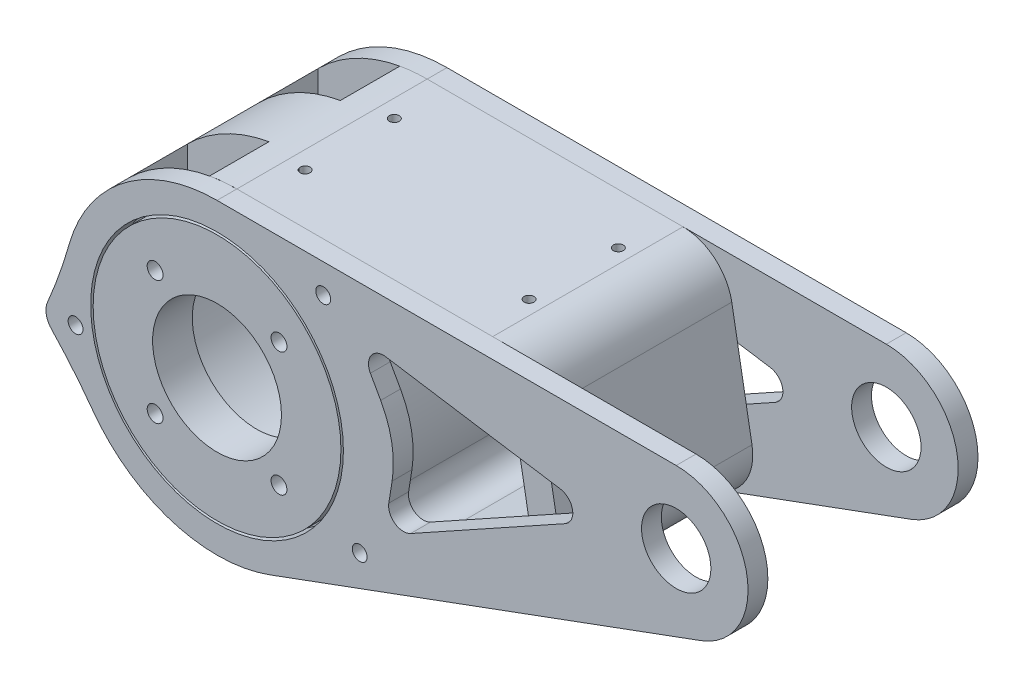
from build123d import *

# Parameters (mm, degrees)
SKETCH_1_R               = 31
SKETCH_1_R_2             = 21
EXTRUDE_1_DEPTH          = 23.2
SKETCH_2_R               = 31
SKETCH_2_R_2             = 13
EXTRUDE_2_DEPTH          = 8
SKETCH_3_R               = 1.6
CUT_EXTRUDE_1_DEPTH      = 64.835413369
EXTRUDE_3_DEPTH          = 46.4
FILLET_1_R               = 10
CUT_EXTRUDE_START        = -4
SKETCH_7_R               = 25
CUT_EXTRUDE_4_DEPTH      = 4
CUT_EXTRUDE_5_DEPTH      = 85.11408343
FILLET_2_R               = 5
SKETCH_9_R               = 7
SKETCH_9_R_2             = 25.5
EXTRUDE_4_DEPTH          = 4
SKETCH_10_R              = 1.5
CUT_EXTRUDE_6_DEPTH      = 121.810533784
EXTRUDE_5_DEPTH          = 38.4
FILLET_3_R               = 100
CUT_EXTRUDE_8_DEPTH      = 120.331408604
CUT_EXTRUDE_8_DEPTH_BACK = 120.331408604
SKETCH_14_R              = 1.5
EXTRUDE_6_DEPTH          = 4
CUT_EXTRUDE_9_DEPTH      = 121.81053381
FILLET_4_R               = 20
FILLET_5_R               = 3
FILLET_6_R               = 20
FILLET_7_R               = 3
SKETCH_19_R              = 7.8
SKETCH_19_R_2            = 7
EXTRUDE_7_DEPTH          = 0.8
SKETCH_20_R              = 7
SKETCH_20_R_2            = 4
EXTRUDE_8_DEPTH          = 4
SKETCH_21_R              = 1
CUT_EXTRUDE_10_DEPTH     = 10
EXTRUDE_START            = -4
EXTRUDE_9_DEPTH          = 4
CUT_EXTRUDE_11_DEPTH     = 12


with BuildPart() as part:
    # 草图1 → 凸台-拉伸1 (new, symmetric)
    with BuildSketch(Plane.XY):
        Circle(SKETCH_1_R)
        Circle(SKETCH_1_R_2, mode=Mode.SUBTRACT)
    extrude(amount=EXTRUDE_1_DEPTH, both=True)

    # 草图2 → 凸台-拉伸2 (add)
    with BuildSketch(Plane.XY.offset(23.2)):
        Circle(SKETCH_2_R)
        Circle(SKETCH_2_R_2, mode=Mode.SUBTRACT)
    extrude(amount=-EXTRUDE_2_DEPTH)

    # 草图3 → 切除-拉伸1 (cut, through all)
    with BuildSketch(Plane.XY.offset(23.2)):
        with Locations((-12.5, 12.5)):
            Circle(SKETCH_3_R)
        with Locations((-12.5, -12.5)):
            Circle(SKETCH_3_R)
        with Locations((12.5, -12.5)):
            Circle(SKETCH_3_R)
        with Locations((12.5, 12.5)):
            Circle(SKETCH_3_R)
    extrude(amount=-CUT_EXTRUDE_1_DEPTH, mode=Mode.SUBTRACT)

    # 草图4 → 凸台-拉伸3 (add)
    with BuildSketch(Plane.XY.offset(23.2)):
        with BuildLine():
            Line((0, 31), (60, 31))
            Line((60, 31), (67.013200828, -8.3803887))
            Line((67.013200828, -8.3803887), (10.702074767, -29.094081798))
            ThreePointArc((10.702074767, -29.094081798), (30.519801242, 5.435230642), (0, 31))
        make_face()
    extrude(amount=-EXTRUDE_3_DEPTH)

    # 圆角1
    fillet_1_edges = [part.edges().sort_by_distance(p)[0] for p in [
        (60, 31, 0),
        (67.013200828, -8.3803887, 0),
    ]]
    fillet(fillet_1_edges, radius=FILLET_1_R)

    # 草图7 → 切除-拉伸4 (cut)
    with BuildSketch(Plane.XY.offset(23.2).offset(CUT_EXTRUDE_START)):
        with BuildLine():
            Line((65.544557076, -0.133688907), (61.468643752, 22.753300207))
            ThreePointArc((61.468643752, 22.753300207), (58.044878134, 28.665931192), (51.623546577, 31))
            Line((51.623546577, 31), (0, 31))
            ThreePointArc((0, 31), (-30.519801242, -5.435230642), (10.702074767, -29.094081798))
            Line((10.702074767, -29.094081798), (59.151742084, -11.272176791))
            ThreePointArc((59.151742084, -11.272176791), (64.372495848, -6.864784556), (65.544557076, -0.133688907))
        make_face()
        Circle(SKETCH_7_R, mode=Mode.SUBTRACT)
    cut_extrude_4 = extrude(amount=CUT_EXTRUDE_4_DEPTH, mode=Mode.SUBTRACT)

    # 镜向1: 切除-拉伸4 across plane
    add(cut_extrude_4.mirror(Plane.XY), mode=Mode.SUBTRACT)

    # 草图8 → 切除-拉伸5 (cut, through all)
    with BuildSketch(Plane.XY.offset(19.2)):
        with BuildLine():
            Line((18.33030278, 25), (54.974127946, 25))
            Line((54.974127946, 25), (60.224956272, -4.484348948))
            Line((60.224956272, -4.484348948), (25.834038634, -17.134831422))
            ThreePointArc((25.834038634, -17.134831422), (30.519801242, 5.435230642), (18.33030278, 25))
        make_face()
    extrude(amount=-CUT_EXTRUDE_5_DEPTH, mode=Mode.SUBTRACT)

    # 圆角2
    fillet_2_edges = [part.edges().sort_by_distance(p)[0] for p in [
        (25.834038634, -17.134831422, 0),
        (18.33030278, 25, 0),
        (54.974127946, 25, 0),
        (60.224956272, -4.484348948, 0),
    ]]
    fillet(fillet_2_edges, radius=FILLET_2_R)


with BuildPart() as body_2:
    # 草图9 → 凸台-拉伸4 (new body)
    with BuildSketch(Plane.XY.offset(19.2)):
        with BuildLine():
            Line((51.623546577, 31), (0, 31))
            ThreePointArc((0, 31), (-30.519801242, -5.435230642), (10.702074767, -29.094081798))
            Line((10.702074767, -29.094081798), (97.656287807, 2.891477869))
            ThreePointArc((97.656287807, 2.891477869), (106.925869546, 19.0422853), (92.650478642, 31))
            Line((92.650478642, 31), (51.623546577, 31))
        make_face()
        with Locations((92.650478642, 16.5)):
            Circle(SKETCH_9_R, mode=Mode.SUBTRACT)
        Circle(SKETCH_9_R_2, mode=Mode.SUBTRACT)
    extrude(amount=EXTRUDE_4_DEPTH)


with BuildPart() as body_3:
    # 镜向4: mirrored copy
    add(body_2.part.mirror(Plane.XY))


with BuildPart() as cut_extrude_6_tool:
    # 草图10 → 切除-拉伸6 (new, through all)
    with BuildSketch(Plane.XY.offset(23.2)):
        with Locations((21.423067361, 25.145619595)):
            Circle(SKETCH_10_R)
        with Locations((28.786928231, -16.203788539)):
            Circle(SKETCH_10_R)
    extrude(amount=-CUT_EXTRUDE_6_DEPTH)


with BuildPart() as part_1:
    add(part.part)

    # 切除-拉伸6: cut by cut_extrude_6_tool
    add(cut_extrude_6_tool.part, mode=Mode.SUBTRACT)

    # 草图13 → 凸台-拉伸5 (add)
    with BuildSketch(Plane.XY.offset(19.2)):
        with BuildLine():
            ThreePointArc((-30.965593216, -1.460149571), (-34.457840112, -6.136550725), (-29.565875221, -9.319818798))
            ThreePointArc((-29.565875221, -9.319818798), (-30.519801242, -5.435230642), (-30.965593216, -1.460149571))
        make_face()
    extrude(amount=-EXTRUDE_5_DEPTH)

    # 圆角3
    fillet_3_edges = [part_1.edges().sort_by_distance(p)[0] for p in [
        (-29.565875221, -9.319818798, 0),
        (-30.965593216, -1.460149571, 0),
    ]]
    fillet(fillet_3_edges, radius=FILLET_3_R)


with BuildPart() as body_2_1:
    add(body_2.part)

    # 切除-拉伸6: cut by cut_extrude_6_tool
    add(cut_extrude_6_tool.part, mode=Mode.SUBTRACT)


with BuildPart() as body_3_1:
    add(body_3.part)

    # 切除-拉伸6: cut by cut_extrude_6_tool
    add(cut_extrude_6_tool.part, mode=Mode.SUBTRACT)


with BuildPart() as cut_extrude_8_tool:
    # 草图14 → 切除-拉伸8 (new, two sides: drawn at the far end of the back side and taken through both)
    with BuildSketch(Plane.XY.offset(19.2).offset(-CUT_EXTRUDE_8_DEPTH_BACK)):
        with Locations((-28.550781807, -5.0845706)):
            Circle(SKETCH_14_R)
    extrude(amount=CUT_EXTRUDE_8_DEPTH + CUT_EXTRUDE_8_DEPTH_BACK)


with BuildPart() as part_2:
    add(part_1.part)

    # 切除-拉伸8: cut by cut_extrude_8_tool
    add(cut_extrude_8_tool.part, mode=Mode.SUBTRACT)

    # 草图21 → 切除-拉伸10 (cut)
    with BuildSketch(Plane(origin=(0, 31, 0), x_dir=(1, 0, 0), z_dir=(0, 1, 0))):
        with Locations(Location((3.570760462, 9, 0), (0, 0, 270))):
            Circle(SKETCH_21_R)
        with Locations(Location((3.570760462, -9, 0), (0, 0, 270))):
            Circle(SKETCH_21_R)
        with Locations(Location((48.770760462, -9, 0), (0, 0, 270))):
            Circle(SKETCH_21_R)
        with Locations(Location((48.770760462, 9, 0), (0, 0, 270))):
            Circle(SKETCH_21_R)
    extrude(amount=-CUT_EXTRUDE_10_DEPTH, mode=Mode.SUBTRACT)

    # 草图23 → 切除-拉伸11 (cut)
    with BuildSketch(Plane.XY.offset(19.2)):
        with BuildLine():
            Line((-22, 21.840329668), (-22, 11.874342087))
            ThreePointArc((-22, 11.874342087), (-12.809009482, 21.46926352), (0, 25))
            Line((0, 25), (-5.506943105, 30.506943105))
            ThreePointArc((-5.506943105, 30.506943105), (-14.419969725, 27.442020209), (-22, 21.840329668))
        make_face()
    cut_extrude_11 = extrude(amount=-CUT_EXTRUDE_11_DEPTH, mode=Mode.SUBTRACT)

    # 镜向5: 切除-拉伸11 across plane
    add(cut_extrude_11.mirror(Plane.XY), mode=Mode.SUBTRACT)


with BuildPart() as body_2_2:
    add(body_2_1.part)

    # 切除-拉伸8: cut by cut_extrude_8_tool
    add(cut_extrude_8_tool.part, mode=Mode.SUBTRACT)

    # 草图16 → 凸台-拉伸6 (add)
    with BuildSketch(Plane.XY.offset(23.2)):
        with BuildLine():
            ThreePointArc((-25.079136482, -18.22188007), (-29.086770055, -13.0686082), (-33.4221003, -8.187804016))
            ThreePointArc((-33.4221003, -8.187804016), (-34.457840112, -6.136550725), (-34.193929379, -3.853844404))
            ThreePointArc((-34.193929379, -3.853844404), (-31.810131913, 2.223560261), (-29.827947457, 8.443550824))
            ThreePointArc((-29.827947457, 8.443550824), (-30.519801242, -5.435230642), (-25.079136482, -18.22188007))
        make_face()
    extrude(amount=-EXTRUDE_6_DEPTH)


with BuildPart() as body_3_2:
    add(body_3_1.part)

    # 切除-拉伸8: cut by cut_extrude_8_tool
    add(cut_extrude_8_tool.part, mode=Mode.SUBTRACT)


with BuildPart() as cut_extrude_9_tool:
    # 草图18 → 切除-拉伸9 (new, through all)
    with BuildSketch(Plane.XY.offset(23.2)):
        Polygon((27.92548444, 21.64482388), (36.426859547, 6.487210766), (33.680995227, -10.673408195), (77.88283288, 13.870049689), align=None)
    extrude(amount=-CUT_EXTRUDE_9_DEPTH)


with BuildPart() as body_2_3:
    add(body_2_2.part)

    # 切除-拉伸9: cut by cut_extrude_9_tool
    add(cut_extrude_9_tool.part, mode=Mode.SUBTRACT)

    # 圆角4
    fillet_4_edges = [body_2_3.edges().sort_by_distance(p)[0] for p in [
        (36.426859547, 6.487210766, 21.2),
    ]]
    fillet(fillet_4_edges, radius=FILLET_4_R)

    # 圆角5
    fillet_5_edges = [body_2_3.edges().sort_by_distance(p)[0] for p in [
        (27.92548444, 21.64482388, 21.2),
        (77.88283288, 13.870049689, 21.2),
        (33.680995227, -10.673408195, 21.2),
    ]]
    fillet(fillet_5_edges, radius=FILLET_5_R)


with BuildPart() as body_3_3:
    add(body_3_2.part)

    # 切除-拉伸9: cut by cut_extrude_9_tool
    add(cut_extrude_9_tool.part, mode=Mode.SUBTRACT)

    # 圆角6
    fillet_6_edges = [body_3_3.edges().sort_by_distance(p)[0] for p in [
        (36.426859547, 6.487210766, -21.2),
    ]]
    fillet(fillet_6_edges, radius=FILLET_6_R)

    # 圆角7
    fillet_7_edges = [body_3_3.edges().sort_by_distance(p)[0] for p in [
        (27.92548444, 21.64482388, -21.2),
        (77.88283288, 13.870049689, -21.2),
        (33.680995227, -10.673408195, -21.2),
    ]]
    fillet(fillet_7_edges, radius=FILLET_7_R)

    # 草图22 → 凸台-拉伸9 (add)
    with BuildSketch(Plane(origin=(0, 0, -23.2), x_dir=(-1, 0, 0), z_dir=(0, 0, -1)).offset(EXTRUDE_START)):
        with BuildLine():
            ThreePointArc((33.4221003, -8.187804016), (29.086770055, -13.0686082), (25.079136482, -18.22188007))
            ThreePointArc((25.079136482, -18.22188007), (30.519801242, -5.435230642), (29.827947457, 8.443550824))
            ThreePointArc((29.827947457, 8.443550824), (31.810131913, 2.223560261), (34.193929379, -3.853844404))
            ThreePointArc((34.193929379, -3.853844404), (34.457840112, -6.136550725), (33.4221003, -8.187804016))
        make_face()
    extrude(amount=EXTRUDE_9_DEPTH)


with BuildPart() as body_4:
    # 草图19 → 凸台-拉伸7 (new body)
    with BuildSketch(Plane(origin=(0, 0, 19.2), x_dir=(-1, 0, 0), z_dir=(0, 0, -1))):
        with Locations((-92.650478642, 16.5)):
            Circle(SKETCH_19_R)
        with Locations(Location((-92.650478642, 16.5, 0), (0, 0, 180))):
            Circle(SKETCH_19_R_2, mode=Mode.SUBTRACT)
    extrude(amount=EXTRUDE_7_DEPTH)

    # 草图20 → 凸台-拉伸8 (add)
    with BuildSketch(Plane(origin=(0, 0, 18.4), x_dir=(-1, 0, 0), z_dir=(0, 0, -1))):
        with Locations(Location((-92.650478642, 16.5, 0), (0, 0, 180))):
            Circle(SKETCH_20_R)
        with Locations((-92.650478642, 16.5)):
            Circle(SKETCH_20_R_2, mode=Mode.SUBTRACT)
    extrude(amount=-EXTRUDE_8_DEPTH)


solid = Compound([part_2.part, body_2_3.part, body_3_3.part])
